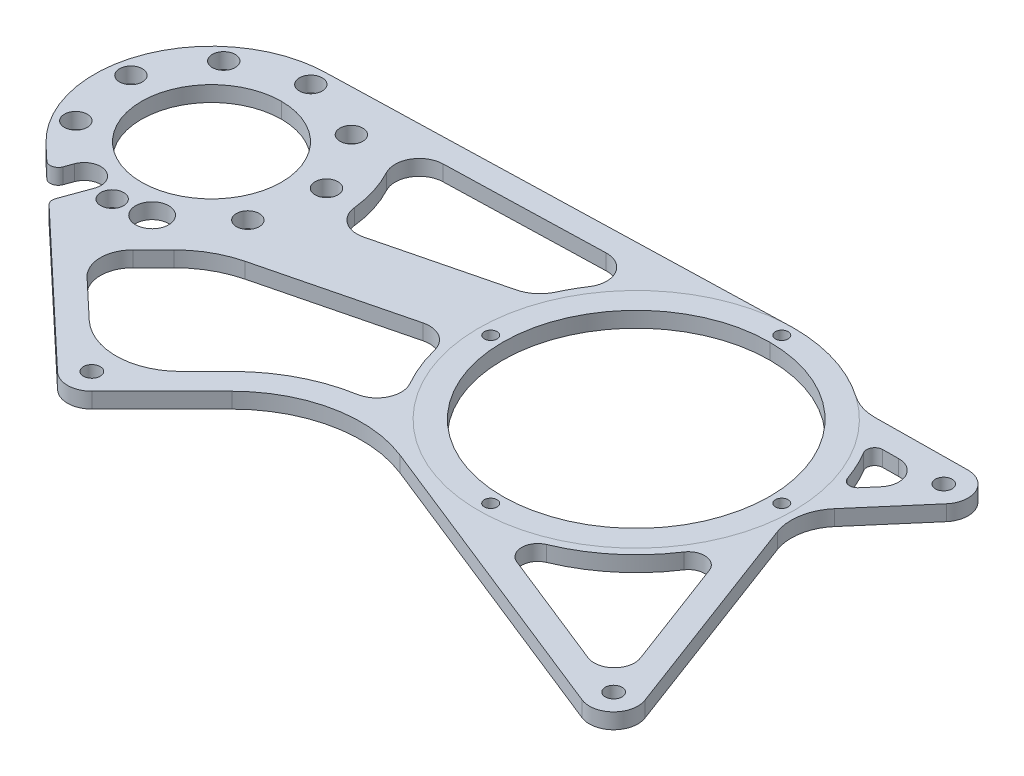
from build123d import *

# Parameters (mm, degrees)
MASTER_SKETCH_R       = 52.451
MASTER_SKETCH_R_2     = 9.525
MASTER_SKETCH_R_3     = 45.974
MASTER_SKETCH_R_4     = 27.4955
MASTER_SKETCH_R_5     = 6.5
BOSS_EXTRUDE2_DEPTH   = 3.048
F_5_0MM_DOWEL_HOLE1_D = 5
CIRPATTERN4_COUNT     = 4
M6_CLEARANCE_HOLE4_D  = 6.6
M8_CLEARANCE_HOLE1_D  = 9
CIRPATTERN3_COUNT     = 18
CUT_EXTRUDE2_DEPTH    = 284.854467488
CUT_EXTRUDE4_DEPTH    = 284.854467488
FILLET1_R             = 3.175


with BuildPart() as part:
    # Master Sketch → Boss-Extrude2 (new, symmetric)
    # profile 1 of 5: a face of its own
    with BuildSketch(Plane(origin=(0, 0, 0), x_dir=(1, 0, 0), z_dir=(0, 1, 0))):
        with BuildLine():
            ThreePointArc((-8.636, 127), (-36.396097826, 84.787887478), (-86.152093601, 93.552952189))
            Line((-86.152093601, 93.552952189), (-6.534964144, 18.470363023))
            ThreePointArc((-6.534964144, 18.470363023), (-3.773598517, 34.145603423), (9.525, 25.4))
            ThreePointArc((9.525, 25.4), (8.799952547, 21.754940307), (6.735192091, 18.664807909))
            Line((6.735192091, 18.664807909), (34.255961574, 46.185577392))
            ThreePointArc((34.255961574, 46.185577392), (59.945142207, 60.02346539), (89.010077776, 57.44457682))
            Line((89.010077776, 57.44457682), (207.987004211, 9.951947906))
            ThreePointArc((207.987004211, 9.951947906), (204.851852042, 25.601533276), (220.43444462, 22.148779315))
            Line((220.43444462, 22.148779315), (189.133864847, 105.44289655))
            ThreePointArc((189.133864847, 105.44289655), (188.207777178, 115.4635324), (192.51641215, 124.557840832))
            Line((192.51641215, 124.557840832), (212.800120602, 148.168522003))
            ThreePointArc((212.800120602, 148.168522003), (196.940842995, 150.353698677), (205.472725722, 163.899866417))
            Line((205.472725722, 163.899866417), (169.599038165, 163.514054819))
            ThreePointArc((169.599038165, 163.514054819), (163.800537316, 164.352688386), (158.531122559, 166.913779261))
            ThreePointArc((158.531122559, 166.913779261), (141.706259737, 175.147152322), (123.19, 177.9778))
            Line((123.19, 177.9778), (-54.61, 172.974))
            ThreePointArc((-54.61, 172.974), (-22.101472842, 159.508527158), (-8.636, 127))
        make_face()
        with Locations(Location((123.19, 116.0018, 0), (0, 0, 90))):
            Circle(MASTER_SKETCH_R, mode=Mode.SUBTRACT)
    # profile 2 of 5: a face of its own
    with BuildSketch(Plane(origin=(0, 0, 0), x_dir=(1, 0, 0), z_dir=(0, 1, 0))):
        with Locations((0, 25.4)):
            Circle(MASTER_SKETCH_R_2)
    # profile 3 of 5: a face of its own
    with BuildSketch(Plane(origin=(0, 0, 0), x_dir=(1, 0, 0), z_dir=(0, 1, 0))):
        with Locations((211.518208908, 18.79820239)):
            Circle(MASTER_SKETCH_R_2)
    # profile 4 of 5: a face of its own
    with BuildSketch(Plane(origin=(0, 0, 0), x_dir=(1, 0, 0), z_dir=(0, 1, 0))):
        with Locations((205.575158542, 154.375417219)):
            Circle(MASTER_SKETCH_R_2)
    # profile 5 of 5: a face of its own
    with BuildSketch(Plane(origin=(0, 0, 0), x_dir=(1, 0, 0), z_dir=(0, 1, 0))):
        with Locations((-54.61, 127)):
            Circle(MASTER_SKETCH_R_3)
        with Locations(Location((-54.61, 127, 0), (0, 0, 90))):
            Circle(MASTER_SKETCH_R_4, mode=Mode.SUBTRACT)
        with Locations(Location((-41.27121441, 90.351987789, 0), (0, 0, 90))):
            Circle(MASTER_SKETCH_R_5, mode=Mode.SUBTRACT)
        with Locations(Location((-67.94878559, 90.351987789, 0), (0, 0, 90))):
            Circle(MASTER_SKETCH_R_5, mode=Mode.SUBTRACT)
    extrude(amount=BOSS_EXTRUDE2_DEPTH, both=True)

    # Ø5.0mm Dowel Hole1 (through all)
    with Locations(Plane(origin=(0, 3.048, 0), x_dir=(1, 0, 0), z_dir=(0, 1, 0))):
        with Locations((123.19, 173.1518)):
            f_5_0mm_dowel_hole1 = Hole(F_5_0MM_DOWEL_HOLE1_D / 2)

    # CirPattern4: Ø5.0mm Dowel Hole1 ×4 about axis
    cirpattern4_axis = Axis((123.19, 0, -116.0018), (0, 1, 0))
    for i in range(1, CIRPATTERN4_COUNT):
        add(f_5_0mm_dowel_hole1.rotate(cirpattern4_axis, i * 360 / CIRPATTERN4_COUNT), mode=Mode.SUBTRACT)

    # M6 Clearance Hole4 (through all)
    with Locations(Plane(origin=(0, 3.048, 0), x_dir=(1, 0, 0), z_dir=(0, 1, 0))):
        with Locations((205.575158542, 154.375417219), (211.518208908, 18.79820239), (0, 25.4)):
            Hole(M6_CLEARANCE_HOLE4_D / 2)

    # M8 Clearance Hole1 (through all)
    with Locations(Plane(origin=(0, 3.048, 0), x_dir=(1, 0, 0), z_dir=(0, 1, 0))):
        with Locations((-54.61, 166)):
            m8_clearance_hole1 = Hole(M8_CLEARANCE_HOLE1_D / 2)

    # CirPattern3: M8 Clearance Hole1 ×18 about axis, 10 skipped
    cirpattern3_axis = Axis((-54.61, 3.048, -127), (0, -1, 0))
    add([m8_clearance_hole1.rotate(cirpattern3_axis, i * 360 / CIRPATTERN3_COUNT) for i in range(1, CIRPATTERN3_COUNT) if i not in (1, 3, 5, 7, 8, 10, 11, 13, 15, 17)], mode=Mode.SUBTRACT)

    # Topology 3 → Cut-Extrude2 (cut, through all)
    with BuildSketch(Plane(origin=(0, 3.048, 0), x_dir=(1, 0, 0), z_dir=(0, 1, 0))):
        with BuildLine():
            Line((148.232551201, 44.060262413), (194.821264757, 25.463207079))
            ThreePointArc((194.821264757, 25.463207079), (203.319232726, 27.16564341), (205.194131764, 35.627233252))
            Line((205.194131764, 35.627233252), (188.900120968, 78.987300553))
            ThreePointArc((188.900120968, 78.987300553), (183.658143307, 83.064639882), (177.648151764, 80.239214699))
            ThreePointArc((177.648151764, 80.239214699), (164.735029841, 65.81551406), (148.153589294, 55.823132596))
            ThreePointArc((148.153589294, 55.823132596), (144.236830733, 49.915140022), (148.232551201, 44.060262413))
        make_face()
        with BuildLine():
            Line((188.044823271, 154.186883307), (181.870154841, 154.120476454))
            ThreePointArc((181.870154841, 154.120476454), (179.135815493, 152.500048502), (179.17593949, 149.321874737))
            ThreePointArc((179.17593949, 149.321874737), (182.248718341, 143.510354832), (184.720207534, 137.418764347))
            ThreePointArc((184.720207534, 137.418764347), (187.127250613, 135.343061567), (190.127076346, 136.393510988))
            Line((190.127076346, 136.393510988), (194.150985671, 141.077429629))
            ThreePointArc((194.150985671, 141.077429629), (195.32544691, 149.601274428), (188.044823271, 154.186883307))
        make_face()
        with BuildLine():
            Line((17.44176984, 42.84176984), (27.520769483, 52.920769483))
            ThreePointArc((27.520769483, 52.920769483), (42.409632623, 63.819008448), (59.896219631, 69.707058463))
            ThreePointArc((59.896219631, 69.707058463), (66.885503662, 75.024623751), (66.553177874, 83.800508404))
            ThreePointArc((66.553177874, 83.800508404), (62.745475764, 91.688999032), (60.030376503, 100.016970919))
            ThreePointArc((60.030376503, 100.016970919), (55.6852269, 105.854731176), (48.48636159, 106.920614917))
            Line((48.48636159, 106.920614917), (-7.457826773, 92.934567826))
            ThreePointArc((-7.457826773, 92.934567826), (-16.98904431, 89.126755018), (-25.157987823, 82.912906934))
            Line((-25.157987823, 82.912906934), (-33.299725858, 74.771168898))
            ThreePointArc((-33.299725858, 74.771168898), (-37.018106584, 65.604842248), (-33.032755262, 56.551396808))
            Line((-33.032755262, 56.551396808), (-17.945313453, 42.323250142))
            ThreePointArc((-17.945313453, 42.323250142), (-0.146601343, 35.405008389), (17.44176984, 42.84176984))
        make_face()
        with BuildLine():
            Line((60.61677272, 166.688039353), (-1.663792567, 164.935286301))
            ThreePointArc((-1.663792567, 164.935286301), (-9.632748017, 160.197249287), (-9.798074059, 150.927626155))
            ThreePointArc((-9.798074059, 150.927626155), (-6.09260405, 142.056636088), (-4.12477238, 132.646396384))
            ThreePointArc((-4.12477238, 132.646396384), (-0.093621954, 125.882803807), (7.651359628, 124.464488392))
            Line((7.651359628, 124.464488392), (55.659374127, 136.466492017))
            ThreePointArc((55.659374127, 136.466492017), (60.668494681, 138.996854714), (64.098067009, 143.438932802))
            ThreePointArc((64.098067009, 143.438932802), (66.306808777, 147.765857633), (68.831828447, 151.916170194))
            ThreePointArc((68.831828447, 151.916170194), (69.209050275, 161.796201373), (60.61677272, 166.688039353))
        make_face()
    extrude(amount=-CUT_EXTRUDE2_DEPTH, mode=Mode.SUBTRACT)

    # Sketch29 → Cut-Extrude4 (cut, through all)
    with BuildSketch(Plane(origin=(0, 3.048, 0), x_dir=(1, 0, 0), z_dir=(0, 1, 0))):
        with BuildLine():
            Line((-74.056787625, 92.575118721), (-76.882563864, 84.811362311))
            Line((-76.882563864, 84.811362311), (-66.583357956, 75.098740778))
            Line((-66.583357956, 75.098740778), (-61.840783555, 88.128856858))
            ThreePointArc((-61.840783555, 88.128856858), (-70.171916521, 84.243985754), (-74.056787625, 92.575118721))
        make_face()
    extrude(amount=-CUT_EXTRUDE4_DEPTH, mode=Mode.SUBTRACT)

    # Fillet1
    fillet1_edges = [part.edges().sort_by_distance(p)[0] for p in [
        (-66.583357956, 0, -75.098740778),
        (-76.882563864, 0, -84.811362311),
    ]]
    fillet(fillet1_edges, radius=FILLET1_R)


solid = part.part
